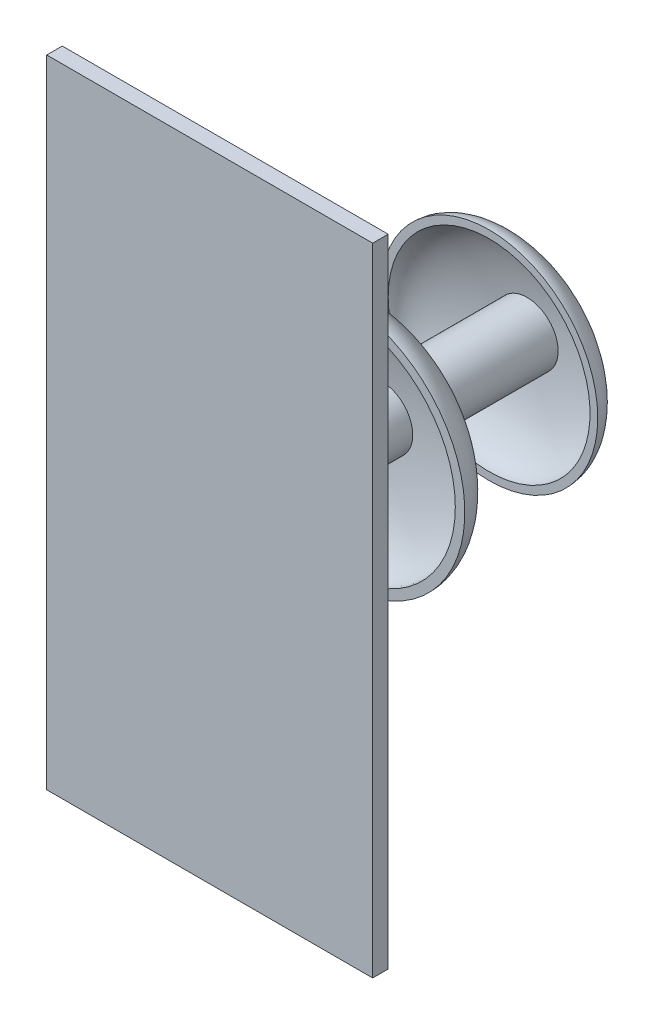
from build123d import *

# Parameters (mm, degrees)
ESQUISSE1_W        = 2.1
ESQUISSE1_H        = 4.1
BOSS_EXTRU_1_DEPTH = 0.1


with BuildPart() as part:
    # Esquisse1 → Boss.-Extru.1 (new body)
    with BuildSketch(Plane.XY):
        with Locations((1.05, 2.05)):
            Rectangle(ESQUISSE1_W, ESQUISSE1_H)
    extrude(amount=BOSS_EXTRU_1_DEPTH)

    # Esquisse7 → Révolution1 (revolve)
    with BuildSketch(Plane(origin=(0, 2.05, 0), x_dir=(1, 0, 0), z_dir=(0, 1, 0)), mode=Mode.PRIVATE) as r_volution1_sk:
        with BuildLine():
            Line((1.25, 0.395972745), (1.25, 0))
            Line((1.25, 0), (1.05, 0))
            Line((1.05, 0), (1.05, 2))
            add(Edge.make_bspline(
                [(1.75, 1.7), (1.75, 2), (1.05, 2)],
                knots=[0, 0, 0, 1.570796327, 1.570796327, 1.570796327], degree=2, weights=[1, 0.707106781, 1]))
            Line((1.75, 1.7), (1.700157336, 1.7))
            add(Edge.make_bspline(
                [(1.700157336, 1.7), (1.700157336, 1.887217668), (1.25, 1.944809164)],
                knots=[0, 0, 0, 1.258107861, 1.258107861, 1.258107861], degree=2, weights=[1, 0.808584519, 1]))
            Line((1.25, 1.944809164), (1.25, 1.402758989))
            Line((1.25, 1.402758989), (1.25, 1.106699238))
            add(Edge.make_bspline(
                [(1.85, 0.743607049), (1.85, 1.0340808), (1.25, 1.106699238)],
                knots=[0, 0, 0, 1.318116072, 1.318116072, 1.318116072], degree=2, weights=[1, 0.790569415, 1]))
            Line((1.85, 0.743607049), (1.788788917, 0.743607049))
            add(Edge.make_bspline(
                [(1.788788917, 0.743607049), (1.788788917, 0.951664265), (1.25, 1.007988124)],
                knots=[0, 0, 0, 1.296662385, 1.296662385, 1.296662385], degree=2, weights=[1, 0.797092629, 1]))
            Line((1.25, 1.007988124), (1.25, 0.395972745))
        make_face()
    revolve(r_volution1_sk.sketch.rotate(Axis((1.05, 2.05, -2), (0, 0, 1)), 180), axis=Axis((1.05, 2.05, -2), (0, 0, 1)))


solid = part.part
